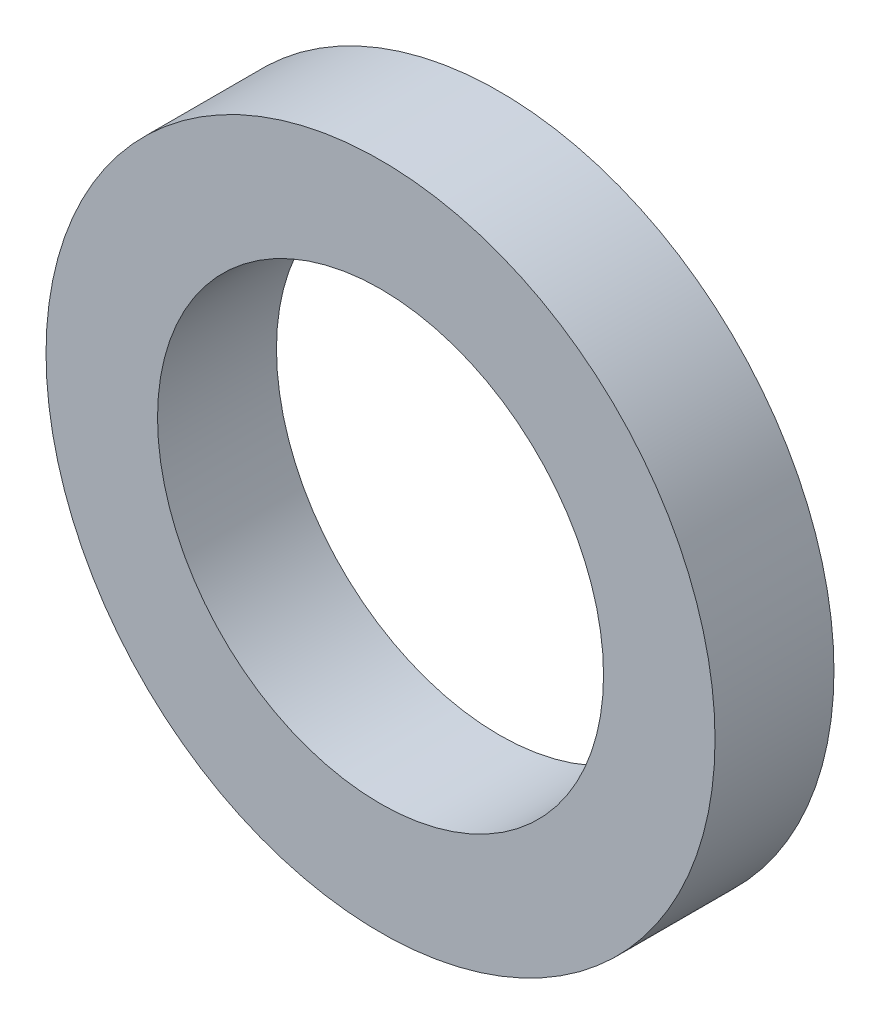
from build123d import *

# Parameters (mm, degrees)
SKETCH1_R           = 22.5
SKETCH1_R_2         = 15
BOSS_EXTRUDE1_DEPTH = 8


with BuildPart() as part:
    # Sketch1 → Boss-Extrude1 (new body)
    with BuildSketch(Plane.XY):
        Circle(SKETCH1_R)
        Circle(SKETCH1_R_2, mode=Mode.SUBTRACT)
    extrude(amount=BOSS_EXTRUDE1_DEPTH)


solid = part.part
